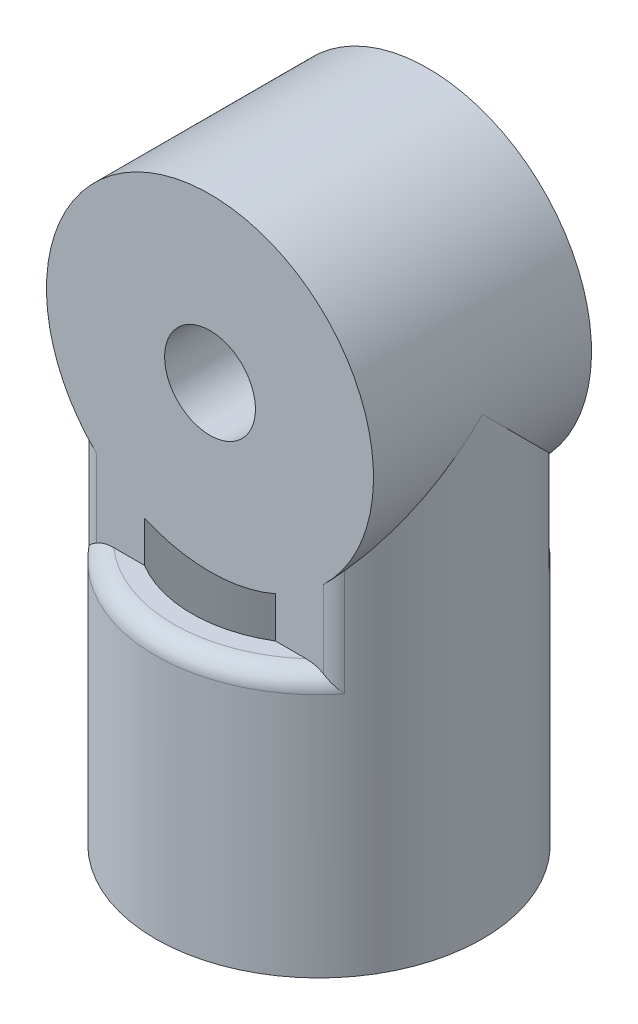
from build123d import *

# Parameters (mm, degrees)
SKETCH1_R                = 9
SKETCH1_R_2              = 7
BOSS_EXTRUDE1_DEPTH      = 25
CUT_EXTRUDE2_DEPTH       = 12
CUT_EXTRUDE2_DEPTH_BACK  = 27
SKETCH2_R                = 9
BOSS_EXTRUDE8_DEPTH      = 9
BOSS_EXTRUDE8_DEPTH_BACK = 9
SKETCH4_R                = 9
SKETCH5_R                = 8
CUT_EXTRUDE3_DEPTH       = 3
CUT_EXTRUDE4_START       = -3
SKETCH6_R                = 8
CUT_EXTRUDE4_DEPTH       = 3
SKETCH7_R                = 2.5
CUT_EXTRUDE5_DEPTH       = 17
CUT_EXTRUDE6_DEPTH       = 15
FILLET2_R                = 1


with BuildPart() as part:
    # Sketch1 → Boss-Extrude1 (new body)
    with BuildSketch(Plane(origin=(0, 0, 0), x_dir=(1, 0, 0), z_dir=(0, 1, 0))):
        Circle(SKETCH1_R)
        Circle(SKETCH1_R_2, mode=Mode.SUBTRACT)
    extrude(amount=BOSS_EXTRUDE1_DEPTH)

    # Sketch2 → Cut-Extrude2 (cut, two sides: drawn at the far end of the back side and taken through both)
    with BuildSketch(Plane.XY.offset(9).offset(-CUT_EXTRUDE2_DEPTH_BACK)):
        with Locations((0, 25)):
            Circle(SKETCH2_R)
    extrude(amount=CUT_EXTRUDE2_DEPTH + CUT_EXTRUDE2_DEPTH_BACK, mode=Mode.SUBTRACT)

    # Sketch4 → Boss-Extrude8 (add, two sides: drawn at the far end of the back side and taken through both)
    with BuildSketch(Plane.XY.offset(-BOSS_EXTRUDE8_DEPTH_BACK)):
        with Locations((0, 25)):
            Circle(SKETCH4_R)
    extrude(amount=BOSS_EXTRUDE8_DEPTH + BOSS_EXTRUDE8_DEPTH_BACK)

    # Sketch5 → Cut-Extrude3 (cut)
    with BuildSketch(Plane.XY.offset(9)):
        with Locations((0, 25)):
            Circle(SKETCH5_R)
    extrude(amount=-CUT_EXTRUDE3_DEPTH, mode=Mode.SUBTRACT)

    # Sketch6 → Cut-Extrude4 (cut)
    with BuildSketch(Plane(origin=(0, 0, -9), x_dir=(-1, 0, 0), z_dir=(0, 0, -1)).offset(CUT_EXTRUDE4_START)):
        with Locations((0, 25)):
            Circle(SKETCH6_R)
    extrude(amount=CUT_EXTRUDE4_DEPTH, mode=Mode.SUBTRACT)

    # Sketch7 → Cut-Extrude5 (cut)
    with BuildSketch(Plane(origin=(0, 0, -6), x_dir=(-1, 0, 0), z_dir=(0, 0, -1))):
        with Locations((0, 25)):
            Circle(SKETCH7_R)
    extrude(amount=-CUT_EXTRUDE5_DEPTH, mode=Mode.SUBTRACT)

    # Sketch8 → Cut-Extrude6 (cut)
    with BuildSketch(Plane.XY.offset(6)):
        with BuildLine():
            Line((-10.5, 25), (-10.5, 14.5))
            Line((-10.5, 14.5), (10.5, 14.5))
            Line((10.5, 14.5), (10.5, 25))
            ThreePointArc((10.5, 25), (0, 35.5), (-10.5, 25))
        make_face()
    cut_extrude6 = extrude(amount=CUT_EXTRUDE6_DEPTH, mode=Mode.SUBTRACT)

    # Mirror1: Cut-Extrude6 across plane
    add(cut_extrude6.mirror(Plane.XY), mode=Mode.SUBTRACT)

    # Fillet2
    fillet2_edges = [part.edges().sort_by_distance(p)[0] for p in [
        (0, 14.5, -9),
        (6.708203932, 16.75, -6),
        (6.708203932, 16.75, 6),
        (-6.708203932, 16.75, 6),
        (-6.708203932, 16.75, -6),
        (0, 14.5, 9),
    ]]
    fillet(fillet2_edges, radius=FILLET2_R)


solid = part.part
